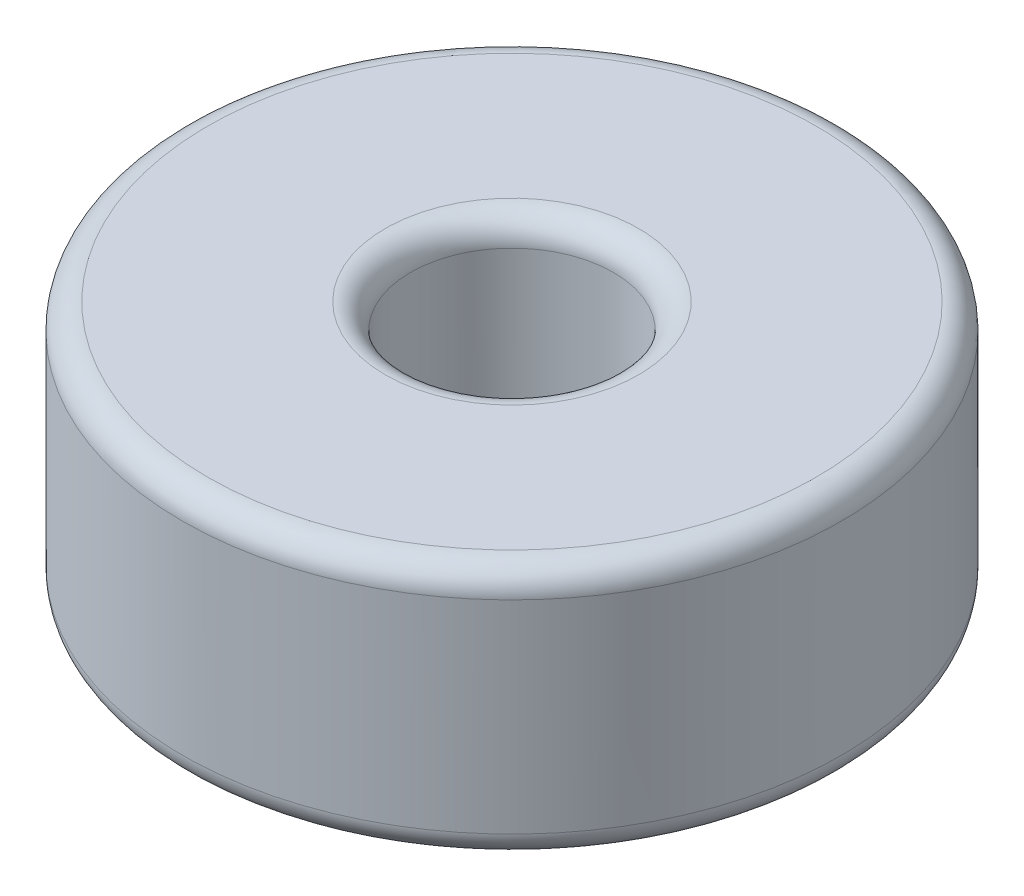
from build123d import *

# Parameters (mm, degrees)
ESQUISSE1_W = 4.5
ESQUISSE1_H = 5
CONG_1_R    = 0.5


with BuildPart() as part:
    # Esquisse1 → Révolution1 (revolve)
    with BuildSketch(Plane.XY, mode=Mode.PRIVATE) as r_volution1_sk:
        with Locations((4.25, 2.5)):
            Rectangle(ESQUISSE1_W, ESQUISSE1_H)
    revolve(r_volution1_sk.sketch.rotate(Axis((0, 0, 0), (0, 1, 0)), 90), axis=Axis((0, 0, 0), (0, 1, 0)))

    # Congé1
    cong_1_edges = [part.edges().sort_by_distance(p)[0] for p in [
        (0, 0, 2),
        (0, 0, 6.5),
        (0, 5, 6.5),
        (0, 5, 2),
    ]]
    fillet(cong_1_edges, radius=CONG_1_R)


solid = part.part
